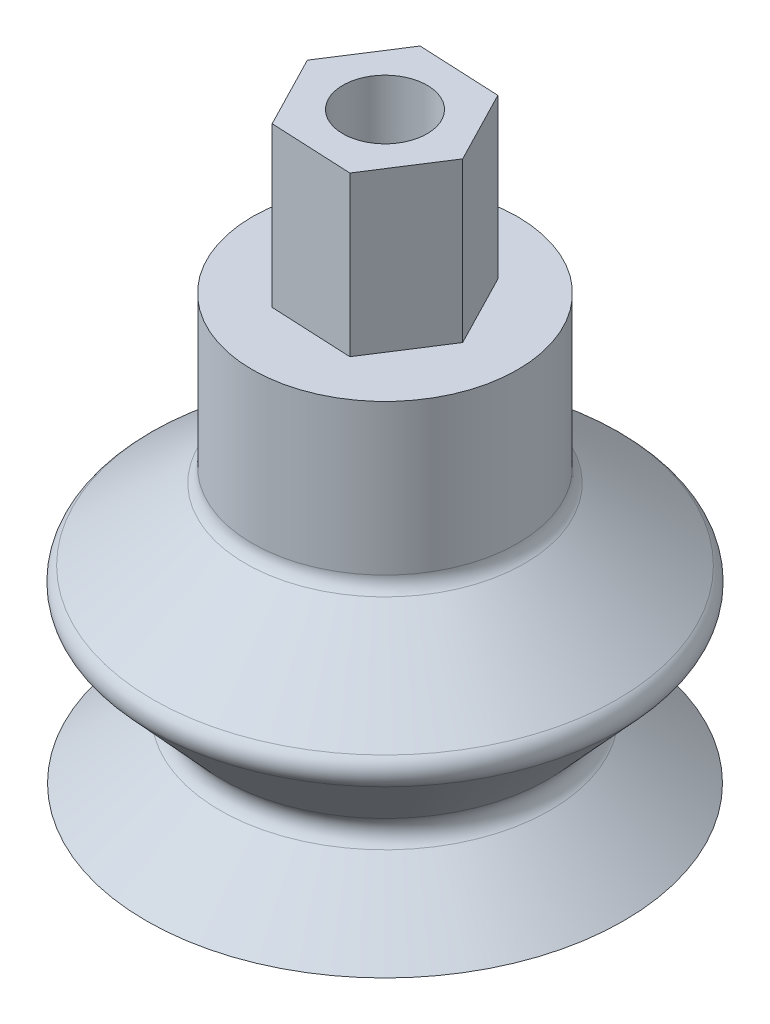
from build123d import *

# Parameters (mm, degrees)
CASCA1_T                 = -0.9
RESSALTO_EXTRUS_O1_DEPTH = 9
FILETE1_R                = 1
ESBO_O3_R                = 2.38125
CORTE_EXTRUS_O1_DEPTH    = 39.143338529


with BuildPart() as part:
    # Esboço1 → Revolução1 (revolve)
    with BuildSketch(Plane.XY, mode=Mode.PRIVATE) as revolu_o1_sk:
        Polygon((0, 0), (13.5, 0), (8.5, 4), (14, 10), (7.5, 15), (7.5, 24), (0, 24), align=None)
    revolve(revolu_o1_sk.sketch.rotate(Axis((0, 24, 0), (0, -1, 0)), 180), axis=Axis((0, 24, 0), (0, -1, 0)))

    # Casca1
    casca1_openings = [part.faces().sort_by_distance(p)[0] for p in [
        (0, 0, 0),
    ]]
    offset(amount=CASCA1_T, openings=casca1_openings, kind=Kind.INTERSECTION)

    # Esboço2 → Ressalto-extrusão1 (add)
    with BuildSketch(Plane(origin=(0, 24, 0), x_dir=(1, 0, 0), z_dir=(0, 1, 0))):
        Polygon((2.496763598, 3.885808136), (-2.11682676, 4.105164771), (-4.613590359, 0.219356636), (-2.496763598, -3.885808136), (2.11682676, -4.105164771), (4.613590359, -0.219356636), align=None)
    extrude(amount=RESSALTO_EXTRUS_O1_DEPTH)

    # Filete1
    filete1_edges = [part.edges().sort_by_distance(p)[0] for p in [
        (7.5, 15, 0),
        (14, 10, 0),
        (8.5, 4, 0),
    ]]
    fillet(filete1_edges, radius=FILETE1_R)

    # Esboço3 → Corte-extrusão1 (cut, through all)
    with BuildSketch(Plane(origin=(0, 33, 0), x_dir=(1, 0, 0), z_dir=(0, 1, 0))):
        with Locations(Location((0, 0, 0), (0, 0, 270))):
            Circle(ESBO_O3_R)
    extrude(amount=-CORTE_EXTRUS_O1_DEPTH, mode=Mode.SUBTRACT)


solid = part.part
